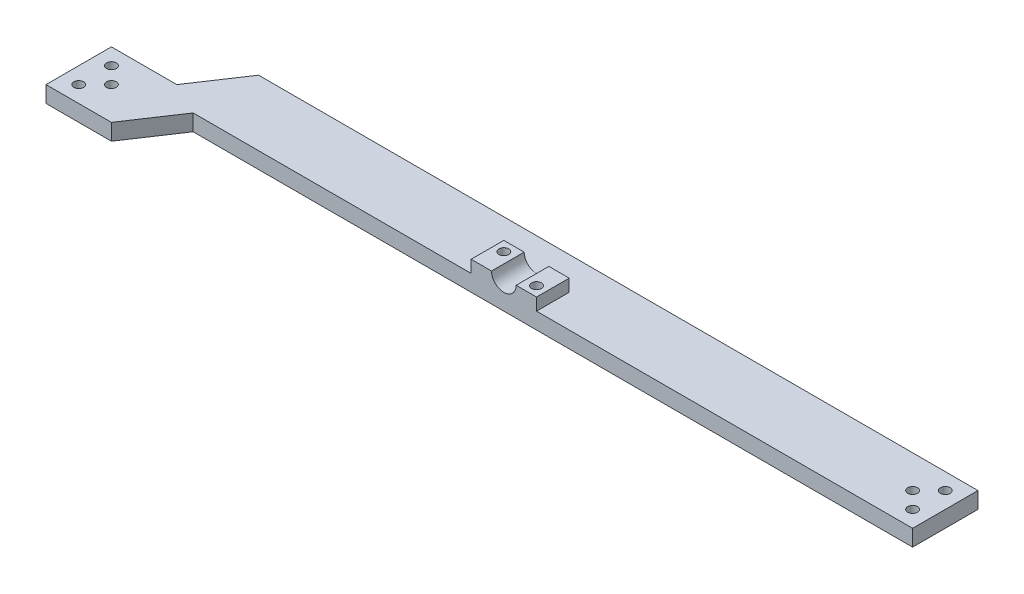
from build123d import *

# Parameters (mm, degrees)
BOSS_EXTRUDE1_DEPTH = 5
SKETCH2_W           = 20
SKETCH2_H           = 10
BOSS_EXTRUDE2_DEPTH = 3.75
SKETCH3_R           = 3.775
CUT_EXTRUDE1_DEPTH  = 10
SKETCH4_R           = 1.5
CUT_EXTRUDE2_DEPTH  = 5
SKETCH5_R           = 1.5
CUT_EXTRUDE3_DEPTH  = 4


with BuildPart() as part:
    # Sketch1 → Boss-Extrude1 (new body)
    with BuildSketch(Plane(origin=(0, 0, 0), x_dir=(1, 0, 0), z_dir=(0, 1, 0))):
        Polygon((-32.518521424, 35), (187.481478576, 35), (187.481478576, 15), (-32.518521424, 15), (-42.518521424, 0), (-62.518521424, 0), (-62.518521424, 20), (-42.518521424, 20), align=None)
    extrude(amount=BOSS_EXTRUDE1_DEPTH)

    # Sketch2 → Boss-Extrude2 (add)
    with BuildSketch(Plane(origin=(0, 5, 0), x_dir=(1, 0, 0), z_dir=(0, 1, 0))):
        with Locations((62.481478576, 20)):
            Rectangle(SKETCH2_W, SKETCH2_H)
    extrude(amount=BOSS_EXTRUDE2_DEPTH)

    # Sketch3 → Cut-Extrude1 (cut)
    with BuildSketch(Plane(origin=(0, 0, -25), x_dir=(-1, 0, 0), z_dir=(0, 0, -1))):
        with Locations((-62.481478576, 8.75)):
            Circle(SKETCH3_R)
    extrude(amount=-CUT_EXTRUDE1_DEPTH, mode=Mode.SUBTRACT)

    # Sketch4 → Cut-Extrude2 (cut)
    with BuildSketch(Plane(origin=(0, 5, 0), x_dir=(1, 0, 0), z_dir=(0, 1, 0))):
        with Locations(Location((182.481478576, 20, 0), (0, 0, 270))):
            Circle(SKETCH4_R)
        with Locations(Location((177.481478576, 25, 0), (0, 0, 270))):
            Circle(SKETCH4_R)
        with Locations(Location((182.481478576, 30, 0), (0, 0, 270))):
            Circle(SKETCH4_R)
        with Locations(Location((-57.518521424, 5, 0), (0, 0, 270))):
            Circle(SKETCH4_R)
        with Locations(Location((-57.518521424, 15, 0), (0, 0, 270))):
            Circle(SKETCH4_R)
        with Locations(Location((-52.518521424, 10, 0), (0, 0, 270))):
            Circle(SKETCH4_R)
    extrude(amount=-CUT_EXTRUDE2_DEPTH, mode=Mode.SUBTRACT)

    # Sketch5 → Cut-Extrude3 (cut)
    with BuildSketch(Plane(origin=(0, 8.75, 0), x_dir=(1, 0, 0), z_dir=(0, 1, 0))):
        with Locations(Location((55.481478576, 22, 0), (0, 0, 270))):
            Circle(SKETCH5_R)
        with Locations(Location((69.481478576, 18, 0), (0, 0, 270))):
            Circle(SKETCH5_R)
    extrude(amount=-CUT_EXTRUDE3_DEPTH, mode=Mode.SUBTRACT)


solid = part.part
